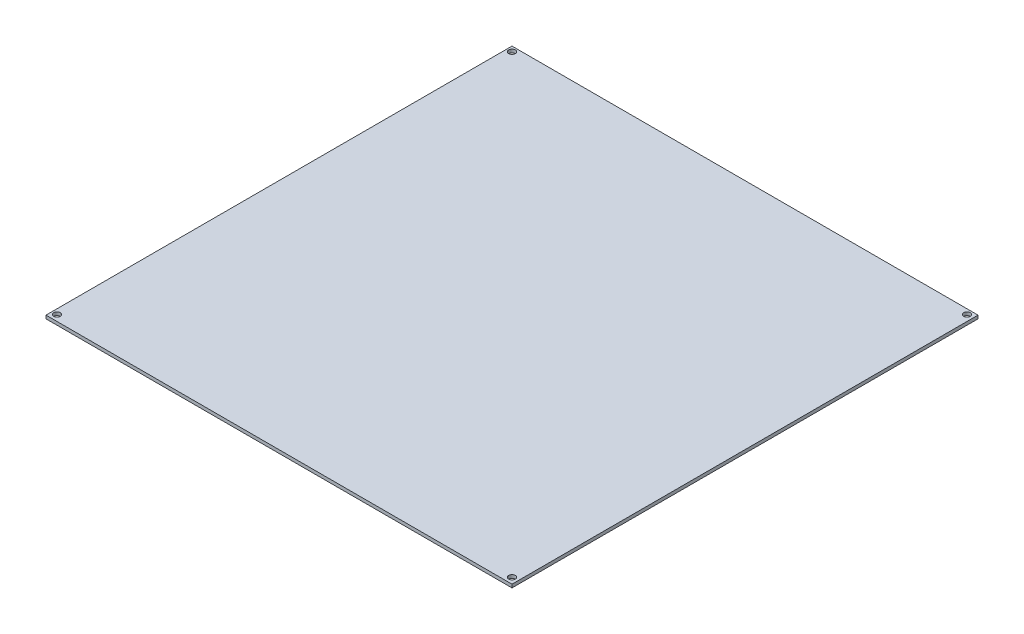
from build123d import *

# Parameters (mm, degrees)
CROQUIS1_W              = 214
CROQUIS1_H              = 214
CROQUIS1_R              = 1.5
SALIENTE_EXTRUIR2_DEPTH = 1.5


with BuildPart() as part:
    # Croquis1 → Saliente-Extruir2 (new body)
    with BuildSketch(Plane(origin=(0, 0, 0), x_dir=(1, 0, 0), z_dir=(0, 1, 0))):
        with Locations((-18.043137255, -45.317647059)):
            Rectangle(CROQUIS1_W, CROQUIS1_H)
        with Locations(Location((-122.793137255, 59.432352941, 0), (0, 0, 270))):
            Circle(CROQUIS1_R, mode=Mode.SUBTRACT)
        with Locations(Location((86.206862745, 59.432352941, 0), (0, 0, 270))):
            Circle(CROQUIS1_R, mode=Mode.SUBTRACT)
        with Locations(Location((-122.793137255, -149.567647059, 0), (0, 0, 270))):
            Circle(CROQUIS1_R, mode=Mode.SUBTRACT)
        with Locations(Location((86.206862745, -149.567647059, 0), (0, 0, 270))):
            Circle(CROQUIS1_R, mode=Mode.SUBTRACT)
    extrude(amount=SALIENTE_EXTRUIR2_DEPTH)


solid = part.part
